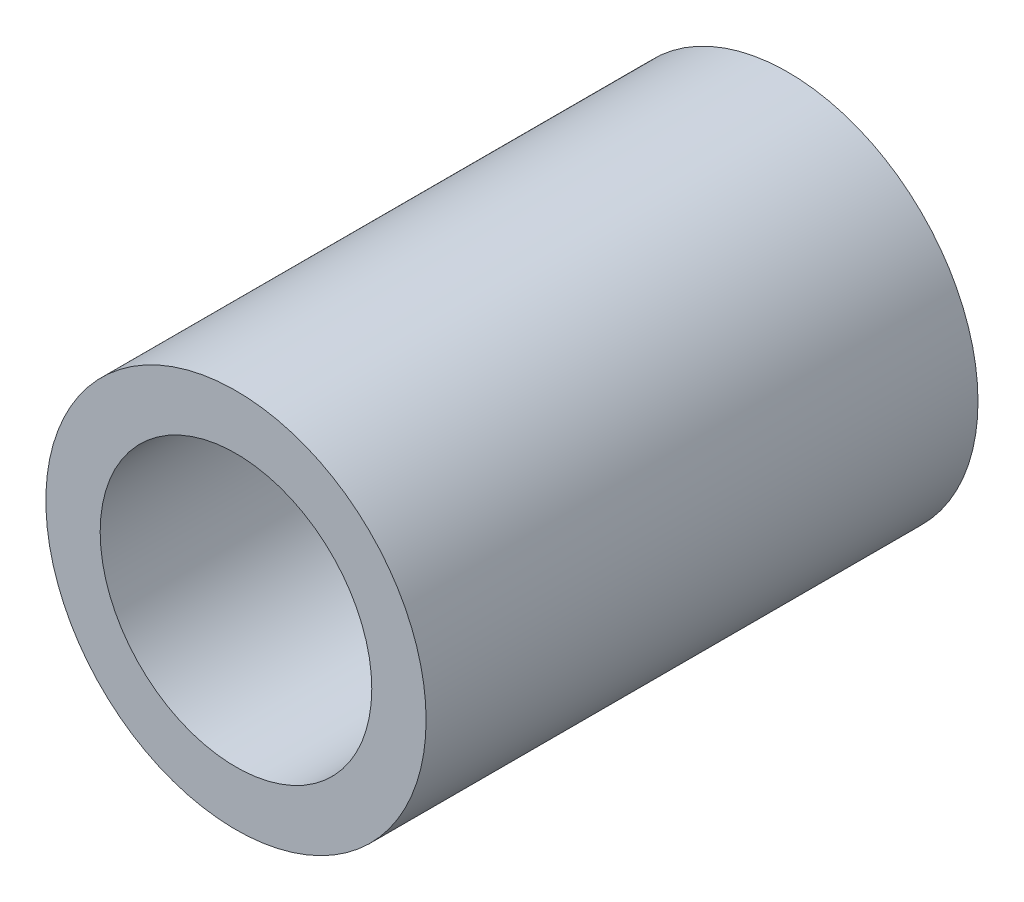
from build123d import *

# Parameters (mm, degrees)
CROQUIS1_R              = 17.5
CROQUIS1_R_2            = 12.5
SALIENTE_EXTRUIR1_DEPTH = 50.8


with BuildPart() as part:
    # Croquis1 → Saliente-Extruir1 (new body)
    with BuildSketch(Plane.XY):
        Circle(CROQUIS1_R)
        Circle(CROQUIS1_R_2, mode=Mode.SUBTRACT)
    extrude(amount=SALIENTE_EXTRUIR1_DEPTH)


solid = part.part
